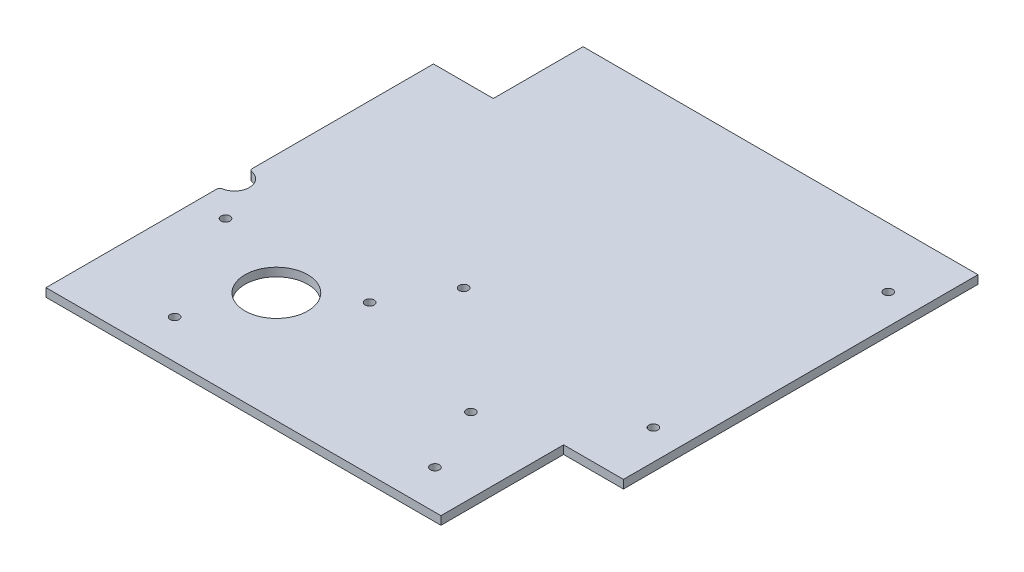
from build123d import *

# Parameters (mm, degrees)
SKETCH1_R           = 1.5
BOSS_EXTRUDE1_DEPTH = 2.8
CUT_EXTRUDE1_REACH  = 112.199
SKETCH2_R           = 1.5
CUT_EXTRUDE2_REACH  = 112.199
SKETCH3_R           = 10.5
CUT_EXTRUDE3_REACH  = 112.199
SKETCH4_R           = 5
FILLET1_R           = 1


with BuildPart() as part:
    # Sketch1 → Boss-Extrude1 (new body)
    with BuildSketch(Plane(origin=(0, 0, 0), x_dir=(1, 0, 0), z_dir=(0, 1, 0))):
        Polygon((-76, -79.75), (56, -79.75), (56, -38.75), (76, -38.75), (76, 79.75), (-56, 79.75), (-56, 49.75), (-76, 49.75), align=None)
        with Locations(Location((-46, -66.75, 0), (0, 0, 270))):
            Circle(SKETCH1_R, mode=Mode.SUBTRACT)
        with Locations(Location((-66, -29.75, 0), (0, 0, 270))):
            Circle(SKETCH1_R, mode=Mode.SUBTRACT)
        with Locations(Location((41, -66.75, 0), (0, 0, 270))):
            Circle(SKETCH1_R, mode=Mode.SUBTRACT)
        with Locations(Location((66, -18.75, 0), (0, 0, 270))):
            Circle(SKETCH1_R, mode=Mode.SUBTRACT)
        with Locations(Location((66, 59.75, 0), (0, 0, 270))):
            Circle(SKETCH1_R, mode=Mode.SUBTRACT)
    extrude(amount=BOSS_EXTRUDE1_DEPTH)

    # Sketch2 → Cut-Extrude1 (cut, up to next)
    with BuildSketch(Plane(origin=(0, 2.8, 0), x_dir=(1, 0, 0), z_dir=(0, 1, 0)), mode=Mode.PRIVATE) as cut_extrude1_sk1:
        with Locations(Location((31, -44.75, 0), (0, 0, 270))):
            Circle(SKETCH2_R)
    cut_extrude1_tool1 = extrude(cut_extrude1_sk1.sketch, amount=-CUT_EXTRUDE1_REACH, mode=Mode.PRIVATE) & part.part
    # Sketch2 → Cut-Extrude1 (cut, up to next)
    with BuildSketch(Plane(origin=(0, 2.8, 0), x_dir=(1, 0, 0), z_dir=(0, 1, 0)), mode=Mode.PRIVATE) as cut_extrude1_sk2:
        with Locations(Location((-6.118257487, -10.040707856, 0), (0, 0, 270))):
            Circle(SKETCH2_R)
    cut_extrude1_tool2 = extrude(cut_extrude1_sk2.sketch, amount=-CUT_EXTRUDE1_REACH, mode=Mode.PRIVATE) & part.part
    # Sketch2 → Cut-Extrude1 (cut, up to next)
    with BuildSketch(Plane(origin=(0, 2.8, 0), x_dir=(1, 0, 0), z_dir=(0, 1, 0)), mode=Mode.PRIVATE) as cut_extrude1_sk3:
        with Locations(Location((-17.618257487, -29.959292144, 0), (0, 0, 270))):
            Circle(SKETCH2_R)
    cut_extrude1_tool3 = extrude(cut_extrude1_sk3.sketch, amount=-CUT_EXTRUDE1_REACH, mode=Mode.PRIVATE) & part.part
    add(cut_extrude1_tool1.solids().sort_by_distance((31, 2.8, 44.75))[0], mode=Mode.SUBTRACT)
    add(cut_extrude1_tool2.solids().sort_by_distance((-6.118257, 2.8, 10.040708))[0], mode=Mode.SUBTRACT)
    add(cut_extrude1_tool3.solids().sort_by_distance((-17.618257, 2.8, 29.959292))[0], mode=Mode.SUBTRACT)

    # Sketch3 → Cut-Extrude2 (cut, up to next)
    with BuildSketch(Plane(origin=(0, 2.8, 0), x_dir=(1, 0, 0), z_dir=(0, 1, 0)), mode=Mode.PRIVATE) as cut_extrude2_sk1:
        with Locations(Location((-36, -42.75, 0), (0, 0, 270))):
            Circle(SKETCH3_R)
    cut_extrude2_tool1 = extrude(cut_extrude2_sk1.sketch, amount=-CUT_EXTRUDE2_REACH, mode=Mode.PRIVATE) & part.part
    add(cut_extrude2_tool1.solids().sort_by_distance((-36, 2.8, 42.75))[0], mode=Mode.SUBTRACT)

    # Sketch4 → Cut-Extrude3 (cut, up to next)
    with BuildSketch(Plane(origin=(0, 2.8, 0), x_dir=(1, 0, 0), z_dir=(0, 1, 0)), mode=Mode.PRIVATE) as cut_extrude3_sk1:
        with Locations((-76, -16.75)):
            Circle(SKETCH4_R)
    cut_extrude3_tool1 = extrude(cut_extrude3_sk1.sketch, amount=-CUT_EXTRUDE3_REACH, mode=Mode.PRIVATE) & part.part
    add(cut_extrude3_tool1.solids().sort_by_distance((-76, 2.8, 16.75))[0], mode=Mode.SUBTRACT)

    # Fillet1
    fillet1_edges = [part.edges().sort_by_distance(p)[0] for p in [
        (-76, 1.4, 21.75),
        (-76, 1.4, 11.75),
    ]]
    fillet(fillet1_edges, radius=FILLET1_R)


solid = part.part
